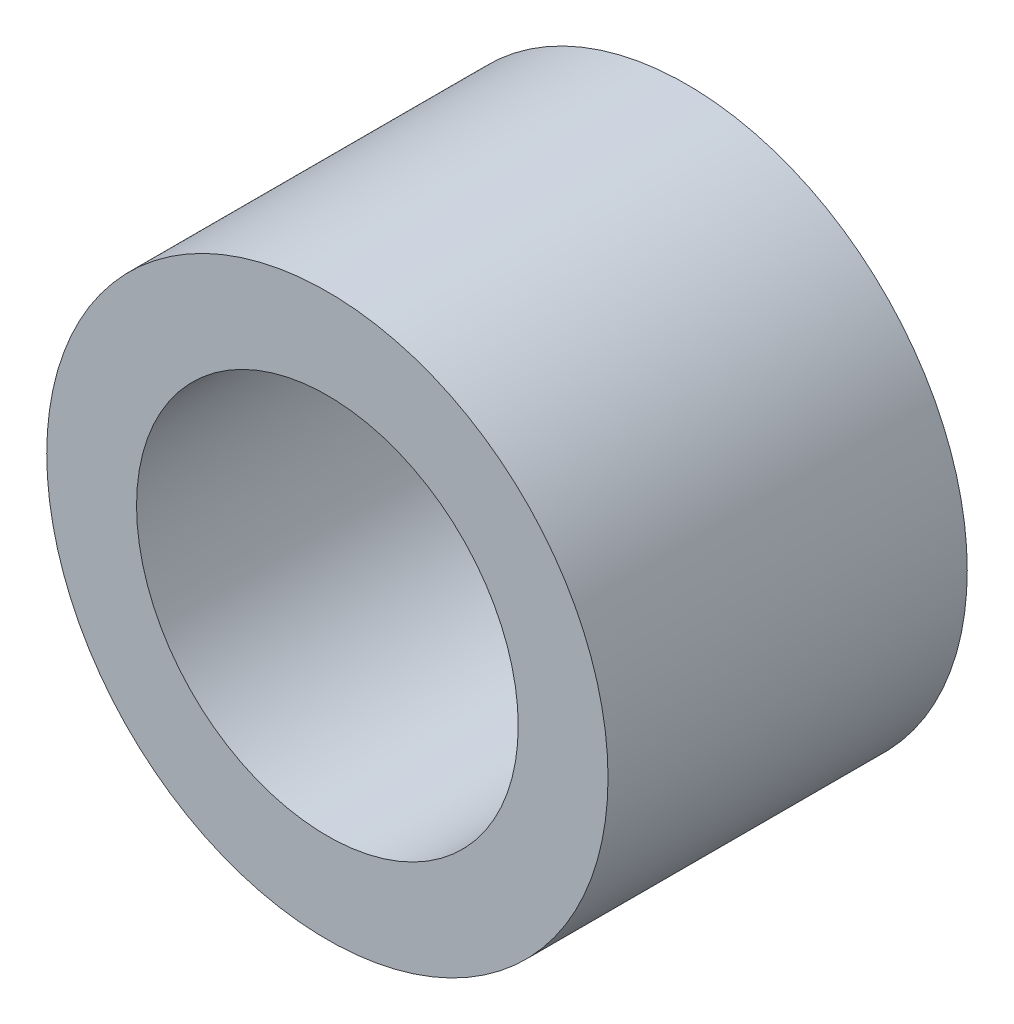
from build123d import *

# Parameters (mm, degrees)
NEEDLE_BEARING_START = 55.5
SKETCH_1_R           = 12.5
SKETCH_1_R_2         = 8.5
NEEDLE_BEARING_DEPTH = 16


with BuildPart() as part:
    # Эскиз1 → Needle_bearing (new body)
    with BuildSketch(Plane.XY.offset(NEEDLE_BEARING_START)):
        Circle(SKETCH_1_R)
        Circle(SKETCH_1_R_2, mode=Mode.SUBTRACT)
    extrude(amount=NEEDLE_BEARING_DEPTH)


solid = part.part
